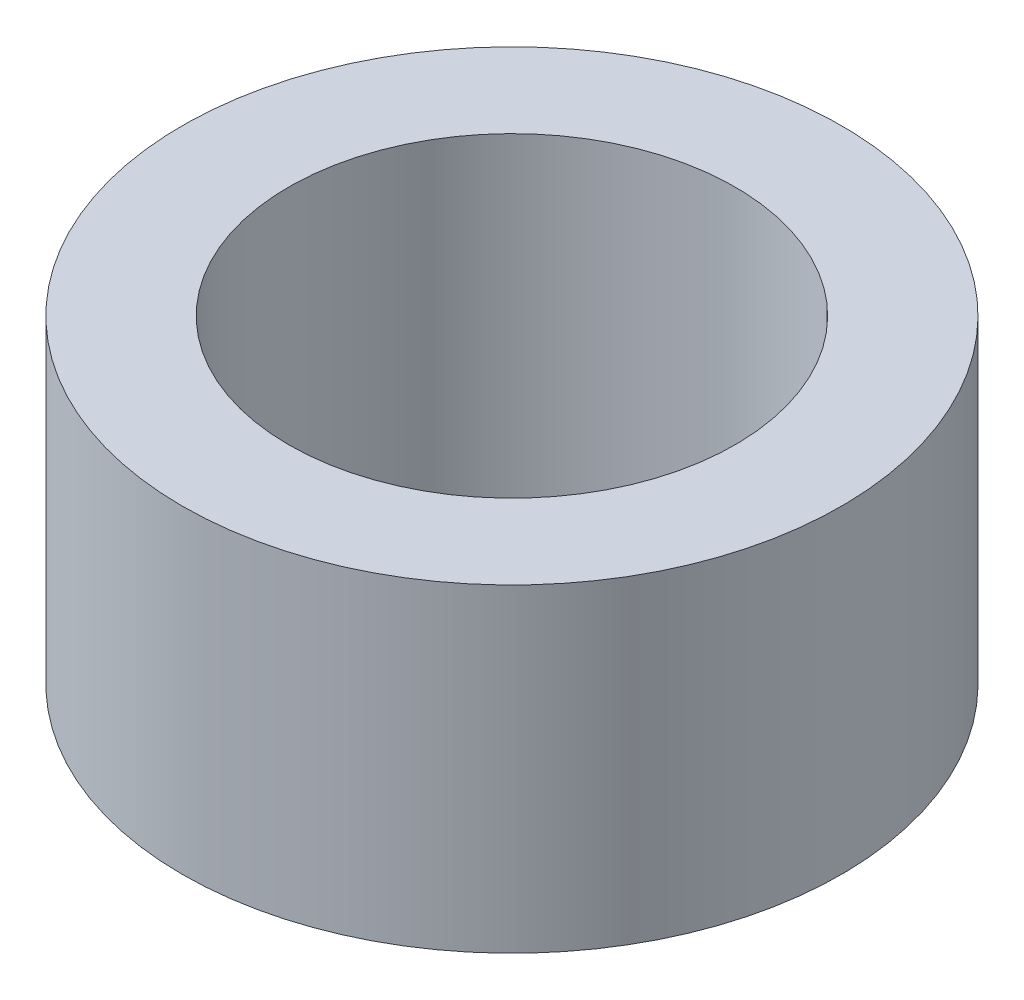
from build123d import *

# Parameters (mm, degrees)
SKETCH1_R           = 3.1
SKETCH1_R_2         = 2.1
BOSS_EXTRUDE1_DEPTH = 3


with BuildPart() as part:
    # Sketch1 → Boss-Extrude1 (new body)
    with BuildSketch(Plane(origin=(0, 0, 0), x_dir=(1, 0, 0), z_dir=(0, 1, 0))):
        with Locations(Location((0, 0, 0), (0, 0, 270))):
            Circle(SKETCH1_R)
        with Locations(Location((0, 0, 0), (0, 0, 270))):
            Circle(SKETCH1_R_2, mode=Mode.SUBTRACT)
    extrude(amount=BOSS_EXTRUDE1_DEPTH)


solid = part.part
